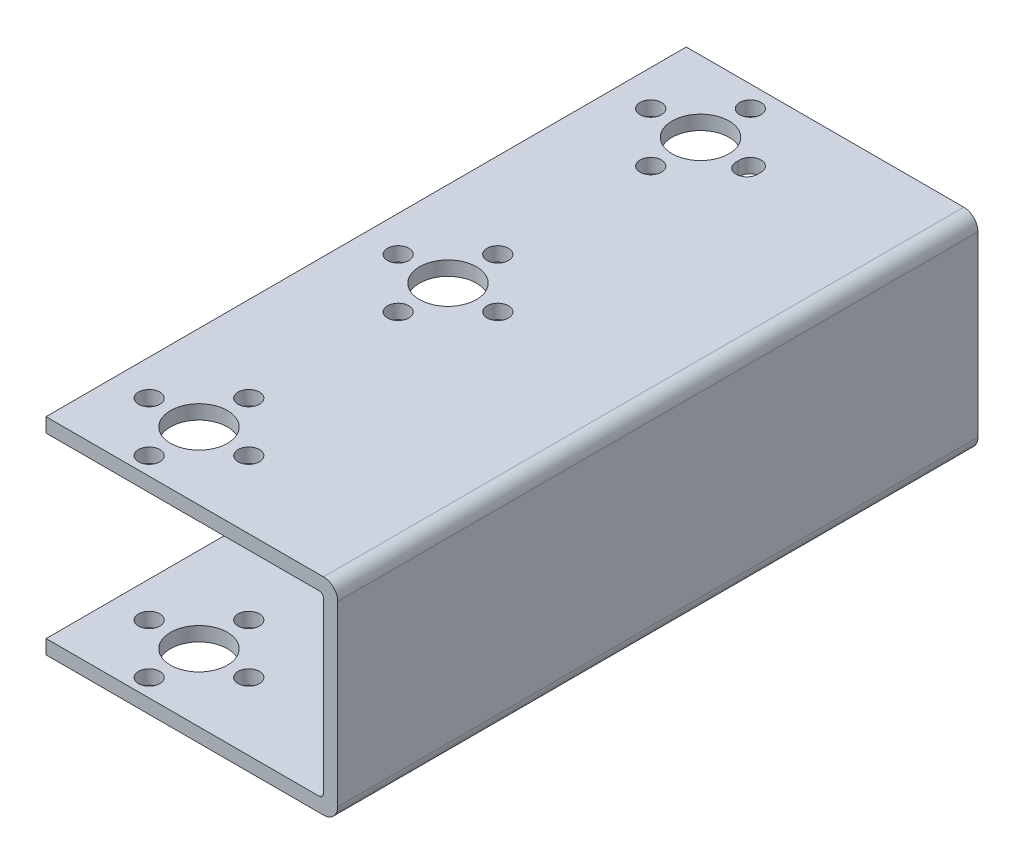
from build123d import *

# Parameters (mm, degrees)
BOSS_EXTRUDE1_DEPTH = 90
SKETCH4_R           = 1.5
SKETCH4_R_2         = 4
CUT_EXTRUDE1_DEPTH  = 31
SKETCH6_R           = 4
SKETCH6_R_2         = 1.5
CUT_EXTRUDE2_DEPTH  = 31


with BuildPart() as part:
    # Sketch3 → Boss-Extrude1 (new body)
    with BuildSketch(Plane.XY):
        with BuildLine():
            Line((-2, 0.049393959), (-41, 0.049393959))
            Line((-41, 0.049393959), (-41, 2.049393959))
            Line((-41, 2.049393959), (-2.618272552, 2.049393959))
            ThreePointArc((-2.618272552, 2.049393959), (-2.194008483, 2.22512989), (-2.018272552, 2.649393959))
            Line((-2.018272552, 2.649393959), (-2.018272552, 26.449393959))
            ThreePointArc((-2.018272552, 26.449393959), (-2.194008483, 26.873658027), (-2.618272552, 27.049393959))
            Line((-2.618272552, 27.049393959), (-41.018189082, 27.049393959))
            Line((-41.018189082, 27.049393959), (-41.018189082, 29.049393959))
            Line((-41.018189082, 29.049393959), (-2.018189082, 29.049393959))
            ThreePointArc((-2.018189082, 29.049393959), (-0.60397552, 28.463607521), (-0.018189082, 27.049393959))
            Line((-0.018189082, 27.049393959), (-0.018189082, 2.049393959))
            ThreePointArc((-0.018189082, 2.049393959), (-0.597554333, 0.64159652), (-2, 0.049393959))
        make_face()
    extrude(amount=BOSS_EXTRUDE1_DEPTH)

    # Sketch4 → Cut-Extrude1 (cut)
    with BuildSketch(Plane(origin=(0, 29.049393959, 0), x_dir=(1, 0, 0), z_dir=(0, 1, 0))):
        with Locations(Location((-29.018189082, -3, 0), (0, 0, 180))):
            Circle(SKETCH4_R)
        with Locations(Location((-36.018189082, -10, 0), (0, 0, 180))):
            Circle(SKETCH4_R)
        with Locations(Location((-29.018189082, -10, 0), (0, 0, 180))):
            Circle(SKETCH4_R_2)
        with Locations(Location((-22.018189082, -10, 0), (0, 0, 180))):
            Circle(SKETCH4_R)
        with Locations(Location((-29.018189082, -17, 0), (0, 0, 180))):
            Circle(SKETCH4_R)
    extrude(amount=-CUT_EXTRUDE1_DEPTH, mode=Mode.SUBTRACT)

    # Sketch6 → Cut-Extrude2 (cut)
    with BuildSketch(Plane(origin=(0, 29.049393959, 0), x_dir=(1, 0, 0), z_dir=(0, 1, 0))):
        with Locations(Location((-29.018189082, -45.498892055, 0), (0, 0, 180))):
            Circle(SKETCH6_R)
        with Locations(Location((-29.018189082, -80.498892055, 0), (0, 0, 180))):
            Circle(SKETCH6_R)
        with Locations(Location((-36.018189082, -45.498892055, 0), (0, 0, 180))):
            Circle(SKETCH6_R_2)
        with Locations(Location((-36.018189082, -80.498892055, 0), (0, 0, 180))):
            Circle(SKETCH6_R_2)
        with Locations((5.981810918, -52.498892055)):
            Circle(SKETCH6_R_2)
        with Locations(Location((-29.018189082, -52.498892055, 0), (0, 0, 180))):
            Circle(SKETCH6_R_2)
        with Locations((-22.018189082, -10.498892055)):
            Circle(SKETCH6_R_2)
        with Locations(Location((-22.018189082, -45.498892055, 0), (0, 0, 180))):
            Circle(SKETCH6_R_2)
        with Locations((-64.018189082, -38.498892055)):
            Circle(SKETCH6_R_2)
        with Locations(Location((-29.018189082, -38.498892055, 0), (0, 0, 180))):
            Circle(SKETCH6_R_2)
        with Locations(Location((-29.018189082, -73.498892055, 0), (0, 0, 180))):
            Circle(SKETCH6_R_2)
        with Locations(Location((-22.018189082, -80.498892055, 0), (0, 0, 180))):
            Circle(SKETCH6_R_2)
        with Locations(Location((-29.018189082, -87.498892055, 0), (0, 0, 180))):
            Circle(SKETCH6_R_2)
    extrude(amount=-CUT_EXTRUDE2_DEPTH, mode=Mode.SUBTRACT)


solid = part.part
